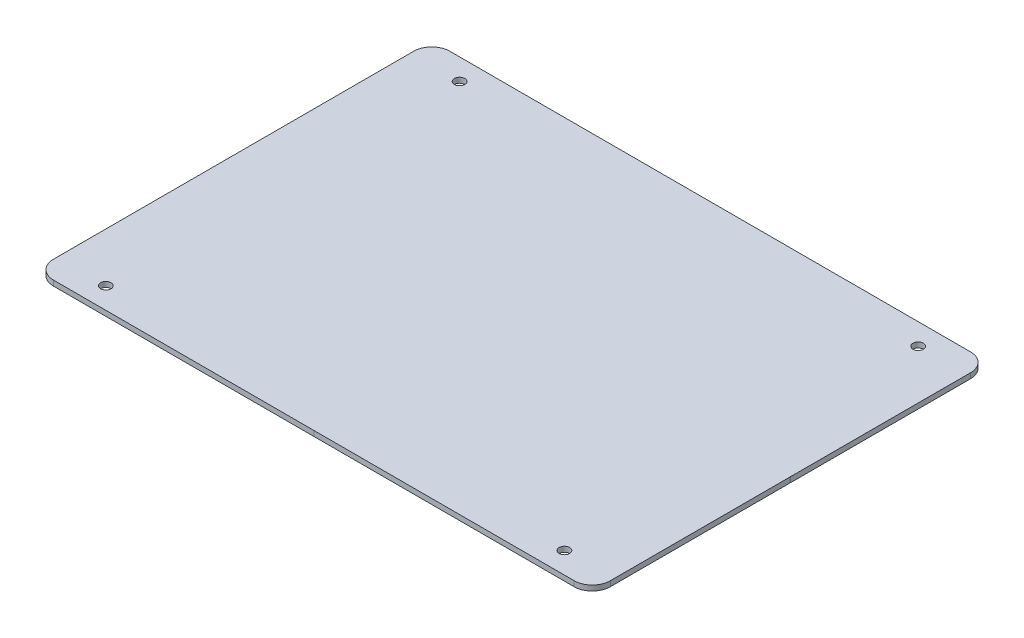
from build123d import *

# Parameters (mm, degrees)
SKIZZE1_R                       = 1.59999934
AUFSATZ_LINEAR_AUSTRAGEN2_DEPTH = 1.6


with BuildPart() as part:
    # Skizze1 → Aufsatz-Linear austragen2 (new body)
    with BuildSketch(Plane(origin=(0, 0, 0), x_dir=(1, 0, 0), z_dir=(0, 1, 0))):
        with BuildLine():
            Line((0.000129244, 60.500005019), (-79.500003496, 60.499998316))
            ThreePointArc((-79.500003496, 60.499998316), (-83.389090307, 58.889085288), (-85.00000145, 54.999997696))
            Line((-85.00000145, 54.999997696), (-85.00000145, -54.999999283))
            ThreePointArc((-85.00000145, -54.999999283), (-83.389089945, -58.889083981), (-79.500005421, -60.499995903))
            Line((-79.500005421, -60.499995903), (-7.348e-06, -60.500004441))
            Line((-7.348e-06, -60.500004441), (79.499997674, -60.499997739))
            ThreePointArc((79.499997674, -60.499997739), (83.389083246, -58.889085422), (84.9999951, -54.999999659))
            Line((84.9999951, -54.999999659), (84.999993197, -0.063514366))
            ThreePointArc((84.999993197, -0.063514366), (84.936493195, -1.4365e-05), (84.999993199, 0.063485634))
            Line((84.999993199, 0.063485634), (84.99999637, 54.999998527))
            ThreePointArc((84.99999637, 54.999998527), (83.389084516, 58.889084164), (79.499999071, 60.499996481))
            Line((79.499999071, 60.499996481), (0.000129244, 60.500005019))
        make_face()
        with Locations(Location((-69.9999997, -54.00000122, 0), (0, 0, 270))):
            Circle(SKIZZE1_R, mode=Mode.SUBTRACT)
        with Locations(Location((69.9999997, -54.00000122, 0), (0, 0, 270))):
            Circle(SKIZZE1_R, mode=Mode.SUBTRACT)
        with Locations(Location((-69.9999997, 54.00000122, 0), (0, 0, 270))):
            Circle(SKIZZE1_R, mode=Mode.SUBTRACT)
        with Locations(Location((69.9999997, 54.00000122, 0), (0, 0, 270))):
            Circle(SKIZZE1_R, mode=Mode.SUBTRACT)
    extrude(amount=AUFSATZ_LINEAR_AUSTRAGEN2_DEPTH)


solid = part.part
